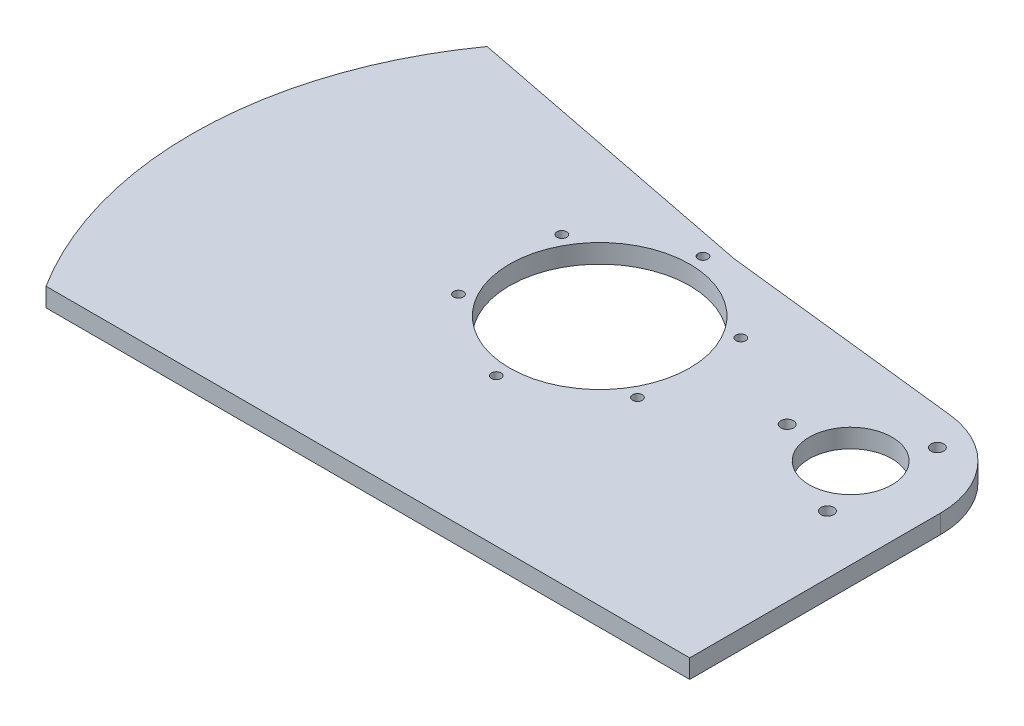
from build123d import *

# Parameters (mm, degrees)
SKETCH1_R             = 30.5
SKETCH1_R_2           = 14
BOSS_EXTRUDE1_DEPTH   = 3.175
M4X0_7_TAPPED_HOLE1_D = 3.3
M4_CLEARANCE_HOLE1_D  = 4.3


with BuildPart() as part:
    # Sketch1 → Boss-Extrude1 (new, symmetric)
    with BuildSketch(Plane(origin=(0, 0, 0), x_dir=(1, 0, 0), z_dir=(0, 1, 0))):
        with BuildLine():
            Line((6.094023378, 39.566801218), (-98.107084352, 60))
            ThreePointArc((-98.107084352, 60), (-122.409547316, -11.830277132), (-102.5, -85))
            Line((-102.5, -85), (115.5, -85))
            Line((115.5, -85), (115.5, 0))
            ThreePointArc((115.5, 0), (107.74004307, 20.325856468), (88.408823529, 30.308908297))
            Line((88.408823529, 30.308908297), (6.094023378, 39.566801218))
        make_face()
        with Locations(Location((0, 0, 0), (0, 0, 270))):
            Circle(SKETCH1_R, mode=Mode.SUBTRACT)
        with Locations(Location((85, 0, 0), (0, 0, 270))):
            Circle(SKETCH1_R_2, mode=Mode.SUBTRACT)
    extrude(amount=BOSS_EXTRUDE1_DEPTH, both=True)

    # M4x0.7 Tapped Hole1 (through all)
    with Locations(Plane(origin=(0, 3.175, 0), x_dir=(1, 0, 0), z_dir=(0, 1, 0))):
        with Locations((-30.310889132, 17.5), (0, 35), (30.310889132, 17.5), (30.310889132, -17.5), (0, -35), (-30.310889132, -17.5)):
            Hole(M4X0_7_TAPPED_HOLE1_D / 2)

    # M4 Clearance Hole1 (through all)
    with Locations(Plane(origin=(0, 3.175, 0), x_dir=(1, 0, 0), z_dir=(0, 1, 0))):
        with Locations((63.5, 0), (95.75, 18.619546181), (95.75, -18.619546181)):
            Hole(M4_CLEARANCE_HOLE1_D / 2)


solid = part.part
